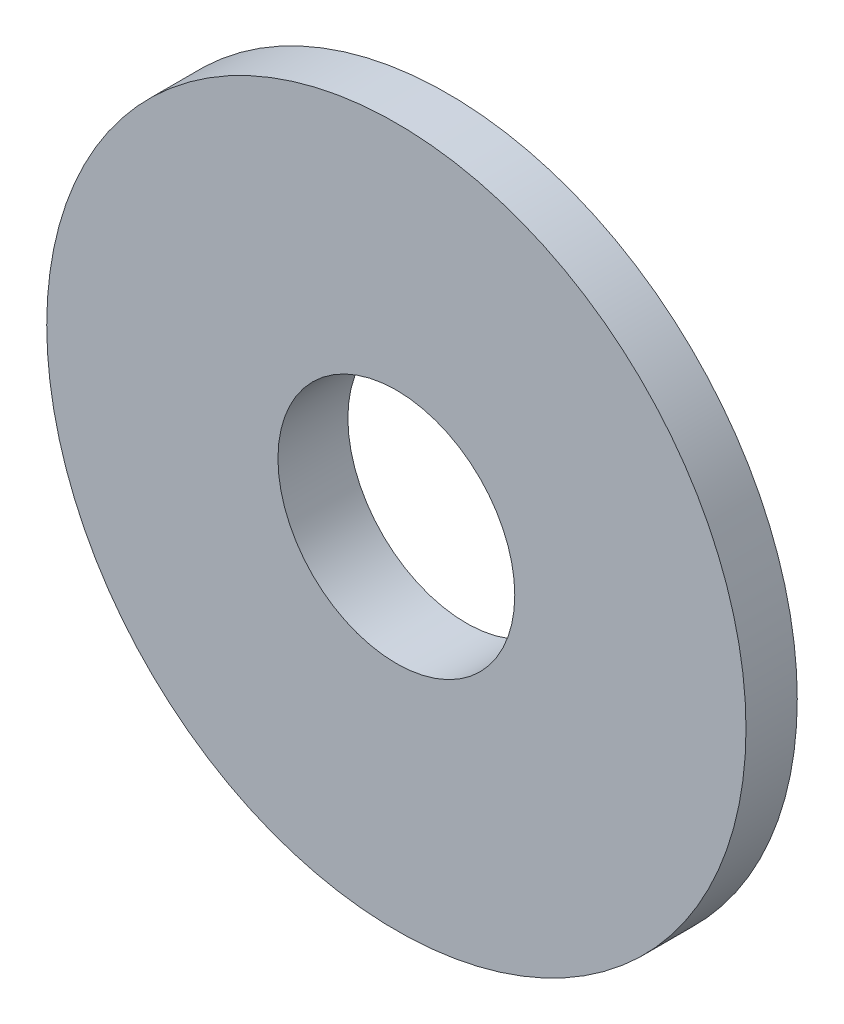
from build123d import *
from build123d.topology import SkipClean

# Parameters (mm, degrees)
SKETCH1_R      = 9.525
SKETCH1_R_2    = 3.2258
EXTRUDE1_DEPTH = 1.397
EXTRUDE2_START = 0.508
SKETCH2_R      = 4.7625
SKETCH2_R_2    = 3.2258
EXTRUDE2_DEPTH = 0.508


with BuildPart() as part:
    # Sketch1 → Extrude1 (new body)
    with BuildSketch(Plane.XY):
        Circle(SKETCH1_R)
        Circle(SKETCH1_R_2, mode=Mode.SUBTRACT)
    extrude(amount=EXTRUDE1_DEPTH)

    # Sketch2 → Extrude2 (add)
    with SkipClean():  # the faces are left unmerged after this step: merging them gives an invalid solid
        with BuildSketch(Plane(origin=(0, 0, 0), x_dir=(-1, 0, 0), z_dir=(0, 0, -1)).offset(EXTRUDE2_START)):
            with Locations(Location((0, 0, 0), (0, 0, 180))):
                Circle(SKETCH2_R)
            Circle(SKETCH2_R_2, mode=Mode.SUBTRACT)
        extrude(amount=-EXTRUDE2_DEPTH)


solid = part.part
